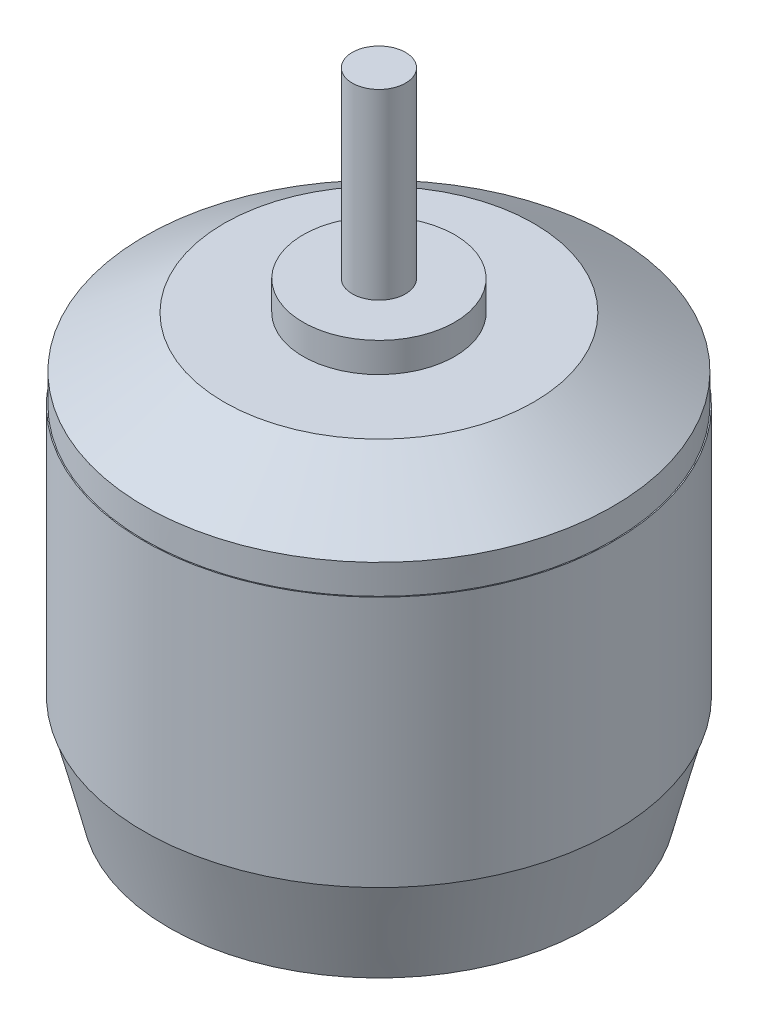
from build123d import *

# Parameters (mm, degrees)
M3X0_5_TAPPED_HOLE1_D           = 2.5
M3X0_5_TAPPED_HOLE1_DEPTH       = 7.499985
M3X0_5_TAPPED_HOLE1_CSINK_D     = 3.05
M3X0_5_TAPPED_HOLE1_CSINK_ANGLE = 90
M3X0_5_TAPPED_HOLE1_TIP         = 0.751075774
M3X0_5_TAPPED_HOLE2_D           = 2.5
M3X0_5_TAPPED_HOLE2_DEPTH       = 7.499985
M3X0_5_TAPPED_HOLE2_CSINK_D     = 3.05
M3X0_5_TAPPED_HOLE2_CSINK_ANGLE = 90
M3X0_5_TAPPED_HOLE2_TIP         = 0.751075774
SKETCH11_W                      = 13.9065
SKETCH11_H                      = 14.8717


with BuildPart() as part:
    # Sketch4 → Revolve1 (revolve)
    with BuildSketch(Plane.XY, mode=Mode.PRIVATE) as revolve1_sk:
        Polygon((0, 0), (1.5748, 0), (1.5748, 1.1049), (3.0099, 1.1049), (3.0099, 2.0574), (12.4079, 2.0574), (13.843, 7.747), (13.843, 24.3586), (9.1567, 27.3558), (4.4831, 27.3558), (4.4831, 29.1084), (1.5748, 29.1084), (1.5748, 39.9034), (0, 39.9034), align=None)
    revolve(revolve1_sk.sketch.rotate(Axis((0, -72.371810048, 0), (0, 1, 0)), 90), axis=Axis((0, -72.371810048, 0), (0, 1, 0)))

    # M3x0.5 Tapped Hole1
    with Locations(Plane(origin=(0, 2.0574, 0), x_dir=(-1, 0, 0), z_dir=(0, -1, 0))):
        with Locations((8, 0), (-8, 0)):
            CounterSinkHole(M3X0_5_TAPPED_HOLE1_D / 2, M3X0_5_TAPPED_HOLE1_CSINK_D / 2, depth=M3X0_5_TAPPED_HOLE1_DEPTH, counter_sink_angle=M3X0_5_TAPPED_HOLE1_CSINK_ANGLE)
            with Locations((0, 0, -(M3X0_5_TAPPED_HOLE1_DEPTH + M3X0_5_TAPPED_HOLE1_TIP / 2))):  # 118° drill point
                Cone(0, M3X0_5_TAPPED_HOLE1_D / 2, M3X0_5_TAPPED_HOLE1_TIP, mode=Mode.SUBTRACT)

    # M3x0.5 Tapped Hole2
    with Locations(Plane(origin=(0, 2.0574, 0), x_dir=(-1, 0, 0), z_dir=(0, -1, 0))):
        with Locations((0, 9.5), (0, -9.5)):
            CounterSinkHole(M3X0_5_TAPPED_HOLE2_D / 2, M3X0_5_TAPPED_HOLE2_CSINK_D / 2, depth=M3X0_5_TAPPED_HOLE2_DEPTH, counter_sink_angle=M3X0_5_TAPPED_HOLE2_CSINK_ANGLE)
            with Locations((0, 0, -(M3X0_5_TAPPED_HOLE2_DEPTH + M3X0_5_TAPPED_HOLE2_TIP / 2))):  # 118° drill point
                Cone(0, M3X0_5_TAPPED_HOLE2_D / 2, M3X0_5_TAPPED_HOLE2_TIP, mode=Mode.SUBTRACT)

    # Sketch11 → Revolve2 (revolve)
    with BuildSketch(Plane.XY, mode=Mode.PRIVATE) as revolve2_sk:
        with Locations((6.95325, 15.18285)):
            Rectangle(SKETCH11_W, SKETCH11_H)
    revolve(revolve2_sk.sketch.rotate(Axis((0, -72.371810048, 0), (0, 1, 0)), 90), axis=Axis((0, -72.371810048, 0), (0, 1, 0)))


solid = part.part
